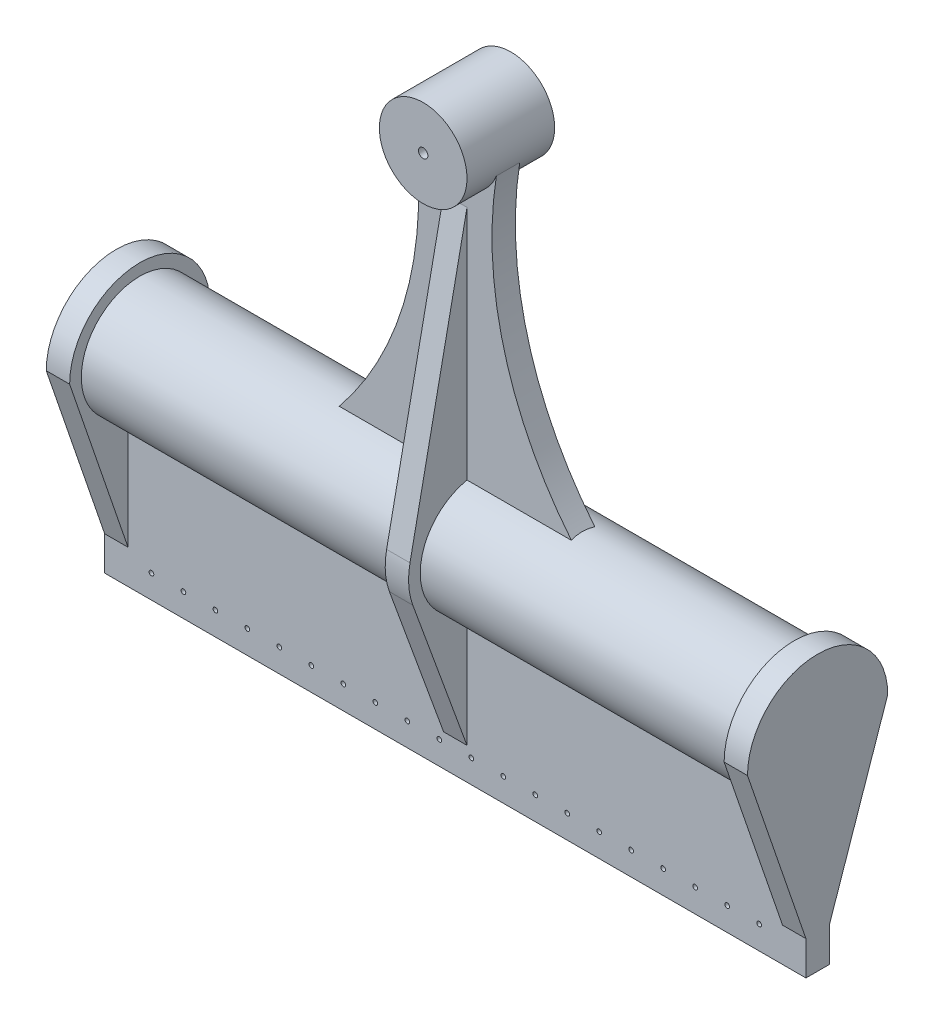
from build123d import *

# Parameters (mm, degrees)
COEFFICIENTS_PLATE_DEPTH      = 2.54
COEFFICIENTS_PLATE_DEPTH_BACK = 2.54
COEFFICIENTS_PLATE_SKETCH_W   = 44.45
COEFFICIENTS_PLATE_SKETCH_H   = 152.4
COEFFICIENTS_PLATE_SKETCH_R   = 0.508
PIVOT_CYLINDER_DEPTH          = 76.2
PIVOT_CYLINDER_DEPTH_BACK     = 76.2
PIVOT_CYLINDER_SKETCH_R       = 12.7
EDGE_START                    = 71.12
EDGE_RIB_FRONT_DEPTH          = 5.08
EDGE_START_2                  = -76.2
EDGE_RIB_BACK_DEPTH           = 5.08
SUMMATION_PLATE_DEPTH         = 2.54
SUMMATION_PLATE_DEPTH_BACK    = 2.54
SUMMATION_ANCHOR_DEPTH        = 9.525
SUMMATION_ANCHOR_DEPTH_BACK   = 9.525
SUMMATION_ANCHOR_SKETCH_R     = 9.525
SUMMATION_ANCHOR_SKETCH_R_2   = 1.016
MIDDLE_RIB_DEPTH              = 2.54
MIDDLE_RIB_DEPTH_BACK         = 2.54


with BuildPart() as part:
    # Coefficients Plate Sketch → Coefficients Plate (new, two sides: drawn at the far end of the back side and taken through both)
    with BuildSketch(Plane(origin=(0, 0, 0), x_dir=(0, 1, 0), z_dir=(0, 0, 1)).offset(-COEFFICIENTS_PLATE_DEPTH_BACK)):
        with Locations((-22.225, 0)):
            Rectangle(COEFFICIENTS_PLATE_SKETCH_W, COEFFICIENTS_PLATE_SKETCH_H)
        with Locations(Location((-39.37, -66.04, 0), (0, 0, 270))):
            Circle(COEFFICIENTS_PLATE_SKETCH_R, mode=Mode.SUBTRACT)
        with Locations(Location((-39.37, -59.088421053, 0), (0, 0, 270))):
            Circle(COEFFICIENTS_PLATE_SKETCH_R, mode=Mode.SUBTRACT)
        with Locations(Location((-39.37, -52.136842105, 0), (0, 0, 270))):
            Circle(COEFFICIENTS_PLATE_SKETCH_R, mode=Mode.SUBTRACT)
        with Locations(Location((-39.37, -45.185263158, 0), (0, 0, 270))):
            Circle(COEFFICIENTS_PLATE_SKETCH_R, mode=Mode.SUBTRACT)
        with Locations(Location((-39.37, -38.233684211, 0), (0, 0, 270))):
            Circle(COEFFICIENTS_PLATE_SKETCH_R, mode=Mode.SUBTRACT)
        with Locations(Location((-39.37, -31.282105263, 0), (0, 0, 270))):
            Circle(COEFFICIENTS_PLATE_SKETCH_R, mode=Mode.SUBTRACT)
        with Locations(Location((-39.37, -24.330526316, 0), (0, 0, 270))):
            Circle(COEFFICIENTS_PLATE_SKETCH_R, mode=Mode.SUBTRACT)
        with Locations(Location((-39.37, -17.378947368, 0), (0, 0, 270))):
            Circle(COEFFICIENTS_PLATE_SKETCH_R, mode=Mode.SUBTRACT)
        with Locations(Location((-39.37, -10.427368421, 0), (0, 0, 270))):
            Circle(COEFFICIENTS_PLATE_SKETCH_R, mode=Mode.SUBTRACT)
        with Locations(Location((-39.37, -3.475789474, 0), (0, 0, 270))):
            Circle(COEFFICIENTS_PLATE_SKETCH_R, mode=Mode.SUBTRACT)
        with Locations(Location((-39.37, 3.475789474, 0), (0, 0, 270))):
            Circle(COEFFICIENTS_PLATE_SKETCH_R, mode=Mode.SUBTRACT)
        with Locations(Location((-39.37, 10.427368421, 0), (0, 0, 270))):
            Circle(COEFFICIENTS_PLATE_SKETCH_R, mode=Mode.SUBTRACT)
        with Locations(Location((-39.37, 17.378947368, 0), (0, 0, 270))):
            Circle(COEFFICIENTS_PLATE_SKETCH_R, mode=Mode.SUBTRACT)
        with Locations(Location((-39.37, 24.330526316, 0), (0, 0, 270))):
            Circle(COEFFICIENTS_PLATE_SKETCH_R, mode=Mode.SUBTRACT)
        with Locations(Location((-39.37, 31.282105263, 0), (0, 0, 270))):
            Circle(COEFFICIENTS_PLATE_SKETCH_R, mode=Mode.SUBTRACT)
        with Locations(Location((-39.37, 38.233684211, 0), (0, 0, 270))):
            Circle(COEFFICIENTS_PLATE_SKETCH_R, mode=Mode.SUBTRACT)
        with Locations(Location((-39.37, 45.185263158, 0), (0, 0, 270))):
            Circle(COEFFICIENTS_PLATE_SKETCH_R, mode=Mode.SUBTRACT)
        with Locations(Location((-39.37, 52.136842105, 0), (0, 0, 270))):
            Circle(COEFFICIENTS_PLATE_SKETCH_R, mode=Mode.SUBTRACT)
        with Locations(Location((-39.37, 59.088421053, 0), (0, 0, 270))):
            Circle(COEFFICIENTS_PLATE_SKETCH_R, mode=Mode.SUBTRACT)
        with Locations(Location((-39.37, 66.04, 0), (0, 0, 270))):
            Circle(COEFFICIENTS_PLATE_SKETCH_R, mode=Mode.SUBTRACT)
    extrude(amount=COEFFICIENTS_PLATE_DEPTH + COEFFICIENTS_PLATE_DEPTH_BACK)

    # Pivot Cylinder Sketch → Pivot Cylinder (add, two sides: drawn at the far end of the back side and taken through both)
    with BuildSketch(Plane.YZ.offset(-PIVOT_CYLINDER_DEPTH_BACK)):
        Circle(PIVOT_CYLINDER_SKETCH_R)
    extrude(amount=PIVOT_CYLINDER_DEPTH + PIVOT_CYLINDER_DEPTH_BACK)

    # Edge Rib Front Sketch → Edge Rib Front (add)
    with BuildSketch(Plane.YZ.offset(EDGE_START)):
        with BuildLine():
            Line((0, 15.24), (-44.45, 0))
            Line((-44.45, 0), (0, -15.24))
            ThreePointArc((0, -15.24), (15.24, 0), (0, 15.24))
        make_face()
    extrude(amount=EDGE_RIB_FRONT_DEPTH)

    # Edge Rib Back Sketch → Edge Rib Back (add)
    with BuildSketch(Plane.YZ.offset(EDGE_START_2)):
        with BuildLine():
            Line((0, 15.24), (-44.45, 0))
            Line((-44.45, 0), (0, -15.24))
            ThreePointArc((0, -15.24), (15.24, 0), (0, 15.24))
        make_face()
    extrude(amount=EDGE_RIB_BACK_DEPTH)

    # Summation Plate Sketch → Summation Plate (add, two sides: drawn at the far end of the back side and taken through both)
    with BuildSketch(Plane(origin=(0, 0, 0), x_dir=(0, 1, 0), z_dir=(0, 0, 1)).offset(-SUMMATION_PLATE_DEPTH_BACK)):
        with BuildLine():
            Line((0, -38.1), (0, 38.1))
            ThreePointArc((0, 38.1), (33.985630195, 12.840847186), (76.2, 9.525))
            Line((76.2, 9.525), (76.2, -9.525))
            ThreePointArc((76.2, -9.525), (33.985630195, -12.840847186), (0, -38.1))
        make_face()
    extrude(amount=SUMMATION_PLATE_DEPTH + SUMMATION_PLATE_DEPTH_BACK)

    # Summation Anchor Sketch → Summation Anchor (add, two sides: drawn at the far end of the back side and taken through both)
    with BuildSketch(Plane(origin=(0, 0, 0), x_dir=(0, 1, 0), z_dir=(0, 0, 1)).offset(-SUMMATION_ANCHOR_DEPTH_BACK)):
        with Locations(Location((76.2, 0, 0), (0, 0, 270))):
            Circle(SUMMATION_ANCHOR_SKETCH_R)
        with Locations(Location((76.2, 0, 0), (0, 0, 270))):
            Circle(SUMMATION_ANCHOR_SKETCH_R_2, mode=Mode.SUBTRACT)
    extrude(amount=SUMMATION_ANCHOR_DEPTH + SUMMATION_ANCHOR_DEPTH_BACK)

    # Middle Rib Sketch → Middle Rib (add, two sides: drawn at the far end of the back side and taken through both)
    with BuildSketch(Plane.YZ.offset(-MIDDLE_RIB_DEPTH_BACK)):
        with BuildLine():
            Line((-44.45, 0), (-5.225026376, 14.316255211))
            ThreePointArc((-5.225026376, 14.316255211), (-1.131177872, 15.197936065), (3.048089123, 14.93207128))
            Line((3.048089123, 14.93207128), (76.2, 0))
            Line((76.2, 0), (3.048089123, -14.93207128))
            ThreePointArc((3.048089123, -14.93207128), (-1.131177872, -15.197936065), (-5.225026376, -14.316255211))
            Line((-5.225026376, -14.316255211), (-44.45, 0))
        make_face()
    extrude(amount=MIDDLE_RIB_DEPTH + MIDDLE_RIB_DEPTH_BACK)


solid = part.part
